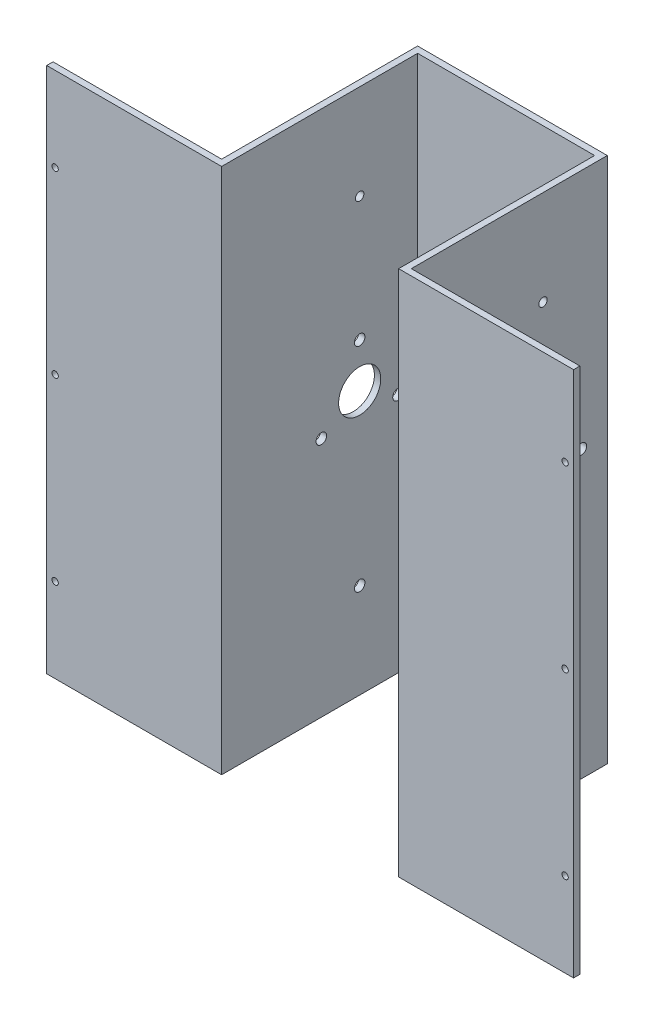
from build123d import *

# Parameters (mm, degrees)
ESQUISSE1_W             = 45
ESQUISSE1_H             = 250
BOSS_EXTRU_2_DEPTH      = 3
ESQUISSE2_W             = 3
ESQUISSE2_H             = 250
BOSS_EXTRU_3_DEPTH      = 90
ESQUISSE3_W             = 83
ESQUISSE3_H             = 250
BOSS_EXTRU_4_DEPTH      = 3
ESQUISSE4_R             = 10
ESQUISSE4_R_2           = 2.5
ESQUISSE4_R_3           = 2
ENL_V_MAT_EXTRU_1_DEPTH = 3
ESQUISSE5_R             = 1.5
ENL_V_MAT_EXTRU_2_DEPTH = 3
ENL_V_START             = -3
ESQUISSE6_R             = 10
ESQUISSE6_R_2           = 2
ESQUISSE6_R_3           = 2.5
ENL_V_MAT_EXTRU_3_DEPTH = 3


with BuildPart() as part:
    # Esquisse1 → Boss.-Extru.2 (new body)
    with BuildSketch(Plane.XY):
        with Locations((-2.435511103, -80.979780034)):
            Rectangle(ESQUISSE1_W, ESQUISSE1_H)
    boss_extru_2 = extrude(amount=BOSS_EXTRU_2_DEPTH)

    # Esquisse2 → Boss.-Extru.3 (add)
    with BuildSketch(Plane.XY.offset(3)):
        with Locations((-23.435511103, -80.979780034)):
            Rectangle(ESQUISSE2_W, ESQUISSE2_H)
    boss_extru_3 = extrude(amount=BOSS_EXTRU_3_DEPTH)

    # Esquisse3 → Boss.-Extru.4 (add)
    with BuildSketch(Plane.XY.offset(93)):
        with Locations((-63.435511103, -80.979780034)):
            Rectangle(ESQUISSE3_W, ESQUISSE3_H)
    boss_extru_4 = extrude(amount=BOSS_EXTRU_4_DEPTH)

    # Esquisse4 → Enlèv. mat.-Extru.1 (cut)
    with BuildSketch(Plane.ZY.offset(24.935511103)):
        with Locations((30.5, -80.979780034)):
            Circle(ESQUISSE4_R)
        with Locations((30.5, -59.979780034)):
            Circle(ESQUISSE4_R_2)
        with Locations((48.686533479, -91.479780034)):
            Circle(ESQUISSE4_R_2)
        with Locations((30.5, -0.979780034)):
            Circle(ESQUISSE4_R_3)
        with Locations((30.5, -160.979780034)):
            Circle(ESQUISSE4_R_2)
        with Locations((12.313466521, -91.479780034)):
            Circle(ESQUISSE4_R_2)
    extrude(amount=-ENL_V_MAT_EXTRU_1_DEPTH, mode=Mode.SUBTRACT)

    # Esquisse5 → Enlèv. mat.-Extru.2 (cut)
    with BuildSketch(Plane.XY.offset(96)):
        with Locations((-100.935511103, -80.979780034)):
            Circle(ESQUISSE5_R)
        with Locations((-100.935511103, 4.020219966)):
            Circle(ESQUISSE5_R)
        with Locations((-100.935511103, -165.979780034)):
            Circle(ESQUISSE5_R)
    enl_v_mat_extru_2 = extrude(amount=-ENL_V_MAT_EXTRU_2_DEPTH, mode=Mode.SUBTRACT)

    # Symétrie1: Boss.-Extru.2, Boss.-Extru.3, Boss.-Extru.4, Enlèv. mat.-Extru.2 across plane
    add(boss_extru_2.mirror(Plane(origin=(20.064488897, 44.020219966, 3), x_dir=(0, 0, 1), z_dir=(1, 0, 0))))
    add(boss_extru_3.mirror(Plane(origin=(20.064488897, 44.020219966, 3), x_dir=(0, 0, 1), z_dir=(1, 0, 0))))
    add(boss_extru_4.mirror(Plane(origin=(20.064488897, 44.020219966, 3), x_dir=(0, 0, 1), z_dir=(1, 0, 0))))
    add(enl_v_mat_extru_2.mirror(Plane(origin=(20.064488897, 44.020219966, 3), x_dir=(0, 0, 1), z_dir=(1, 0, 0))), mode=Mode.SUBTRACT)

    # Esquisse6 → Enlèv. mat.-Extru.3 (cut)
    with BuildSketch(Plane(origin=(65.064488897, 0, 0), x_dir=(0, 0, -1), z_dir=(1, 0, 0)).offset(ENL_V_START)):
        with Locations((-30.5, -80.979780034)):
            Circle(ESQUISSE6_R)
        with Locations((-30.5, -0.979780034)):
            Circle(ESQUISSE6_R_2)
        with Locations((-30.5, -160.979780034)):
            Circle(ESQUISSE6_R_3)
        with Locations((-30.5, -101.979780034)):
            Circle(ESQUISSE6_R_3)
        with Locations((-48.686533479, -70.479780034)):
            Circle(ESQUISSE6_R_3)
        with Locations((-12.313466521, -70.479780034)):
            Circle(ESQUISSE6_R_3)
    extrude(amount=ENL_V_MAT_EXTRU_3_DEPTH, mode=Mode.SUBTRACT)


solid = part.part
